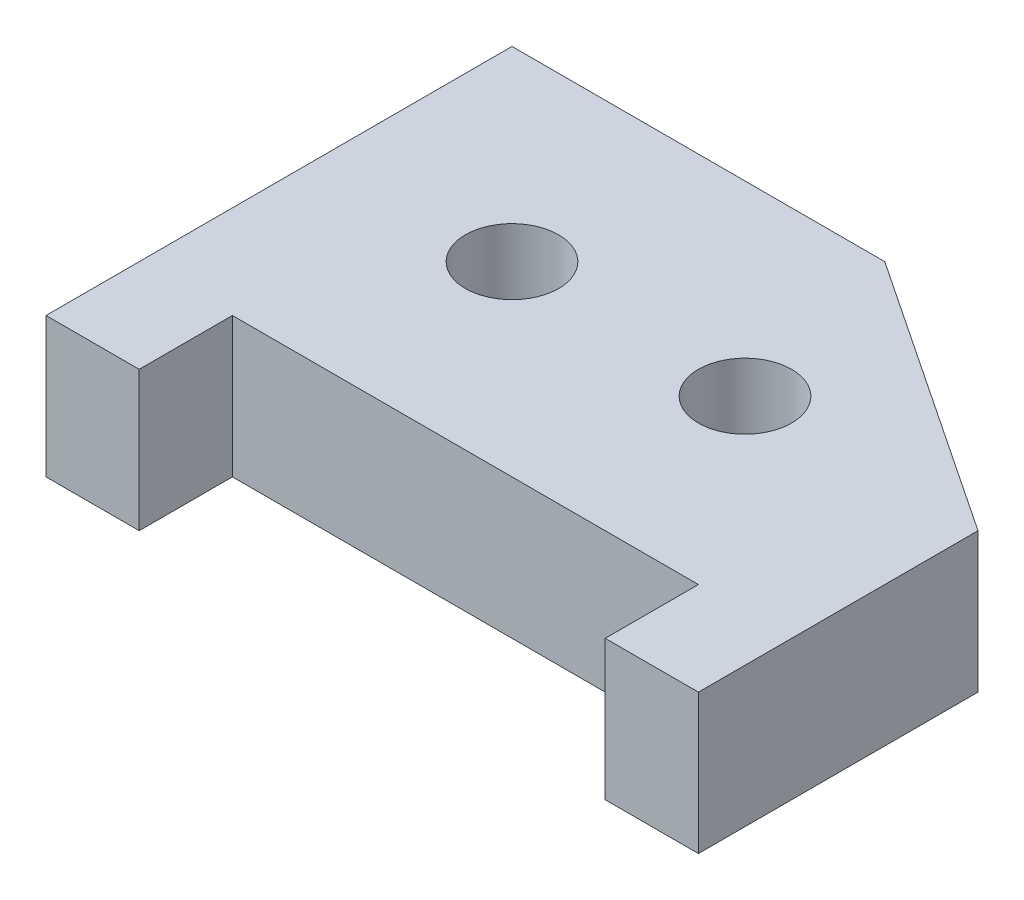
from build123d import *

# Parameters (mm, degrees)
SKETCH1_R           = 6.35
BOSS_EXTRUDE1_DEPTH = 19.05


with BuildPart() as part:
    # Sketch1 → Boss-Extrude1 (new body)
    with BuildSketch(Plane(origin=(0, 0, 0), x_dir=(1, 0, 0), z_dir=(0, 1, 0))):
        Polygon((-88.9, 0), (-76.2, 0), (-76.2, 12.7), (-12.7, 12.7), (-12.7, 0), (0, 0), (0, 38.1), (-38.1, 63.5), (-88.9, 63.5), align=None)
        with Locations(Location((-63.5, 38.1, 0), (0, 0, 90))):
            Circle(SKETCH1_R, mode=Mode.SUBTRACT)
        with Locations(Location((-31.75, 38.1, 0), (0, 0, 90))):
            Circle(SKETCH1_R, mode=Mode.SUBTRACT)
    extrude(amount=BOSS_EXTRUDE1_DEPTH)


solid = part.part
